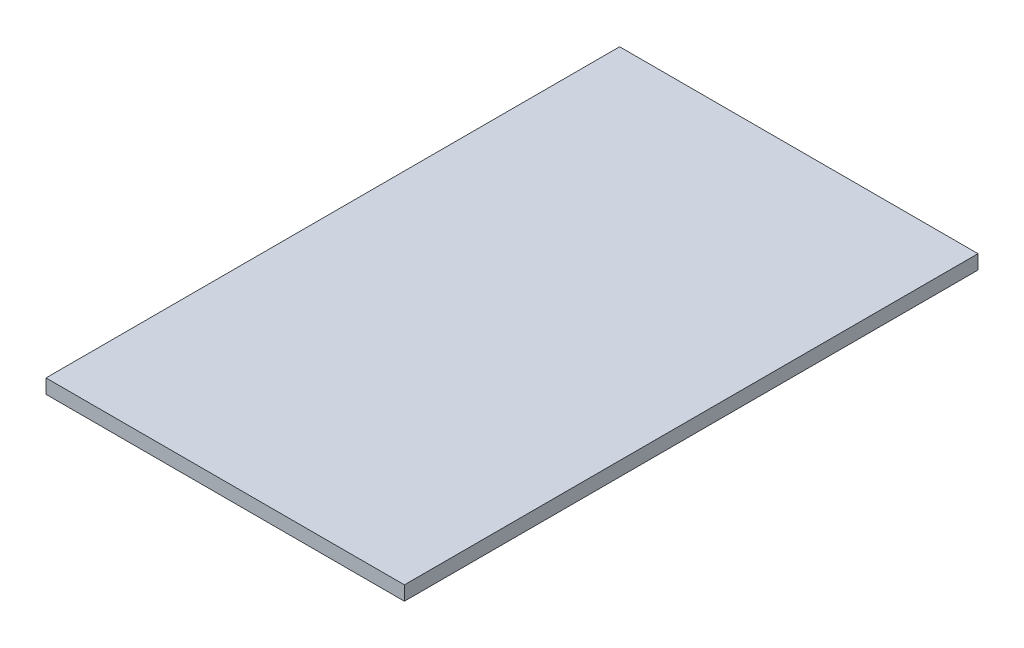
from build123d import *

# Parameters (mm, degrees)
SKETCH1_W           = 75.6
SKETCH1_H           = 121
BOSS_EXTRUDE1_DEPTH = 3


with BuildPart() as part:
    # Sketch1 → Boss-Extrude1 (new body)
    with BuildSketch(Plane(origin=(0, 0, 0), x_dir=(1, 0, 0), z_dir=(0, 1, 0))):
        with Locations((2.386363636, -36.827272727)):
            Rectangle(SKETCH1_W, SKETCH1_H)
    extrude(amount=BOSS_EXTRUDE1_DEPTH)


solid = part.part
